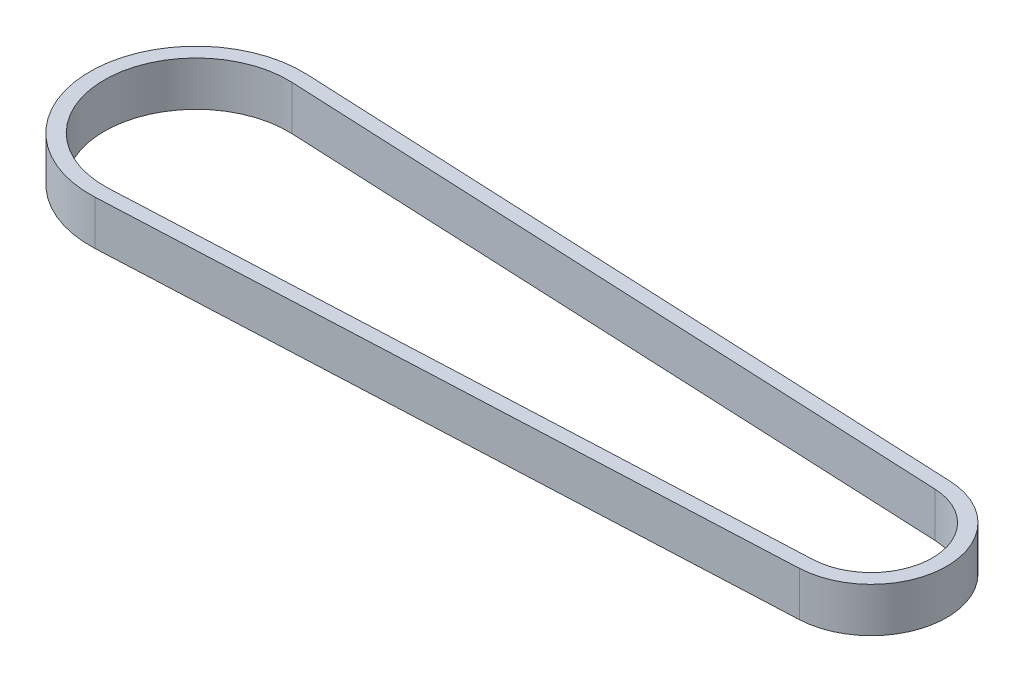
from build123d import *

# Parameters (mm, degrees)
BOSS_EXTRUDE1_DEPTH = 9.25


with BuildPart() as part:
    # Sketch1 → Boss-Extrude1 (new body)
    with BuildSketch(Plane(origin=(0, 0, 0), x_dir=(1, 0, 0), z_dir=(0, 1, 0))):
        with BuildLine():
            Line((-69.19400532, 22.077028119), (70.917048059, 15.68368061))
            ThreePointArc((70.917048059, 15.68368061), (85.901392742, 0), (70.917048059, -15.68368061))
            Line((70.917048059, -15.68368061), (-69.19400532, -22.077028119))
            ThreePointArc((-69.19400532, -22.077028119), (-92.301392742, 0), (-69.19400532, 22.077028119))
        make_face()
        with BuildLine():
            Line((-69.330754744, 19.080146474), (70.780298635, 12.686798965))
            ThreePointArc((70.780298635, 12.686798965), (82.901392742, 0), (70.780298635, -12.686798965))
            Line((70.780298635, -12.686798965), (-69.330754744, -19.080146474))
            ThreePointArc((-69.330754744, -19.080146474), (-89.301392742, 0), (-69.330754744, 19.080146474))
        make_face(mode=Mode.SUBTRACT)
    extrude(amount=BOSS_EXTRUDE1_DEPTH)


solid = part.part
